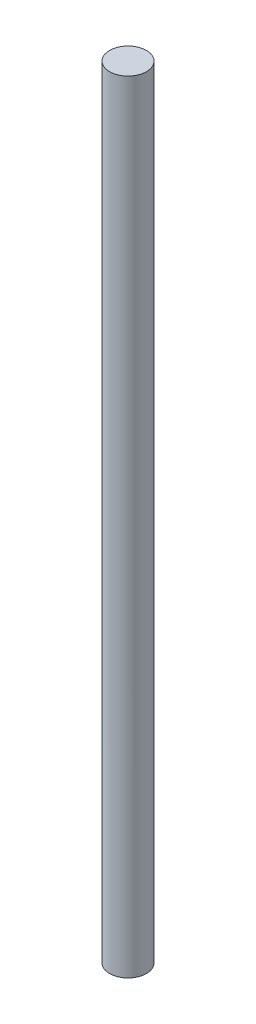
from build123d import *

# Parameters (mm, degrees)
BOSS_EXTRUDE2_DEPTH      = 134.562647
BOSS_EXTRUDE2_DEPTH_BACK = 134.562647
SKETCH2_R                = 6.35


with BuildPart() as part:
    # Sketch2 → Boss-Extrude2 (new, two sides: drawn at the far end of the back side and taken through both)
    with BuildSketch(Plane(origin=(0, 159.962646552, 0), x_dir=(1, 0, 0), z_dir=(0, 1, 0)).offset(-BOSS_EXTRUDE2_DEPTH_BACK)):
        with Locations(Location((0, 0, 0), (0, 0, 90))):
            Circle(SKETCH2_R)
    extrude(amount=BOSS_EXTRUDE2_DEPTH + BOSS_EXTRUDE2_DEPTH_BACK)


solid = part.part
